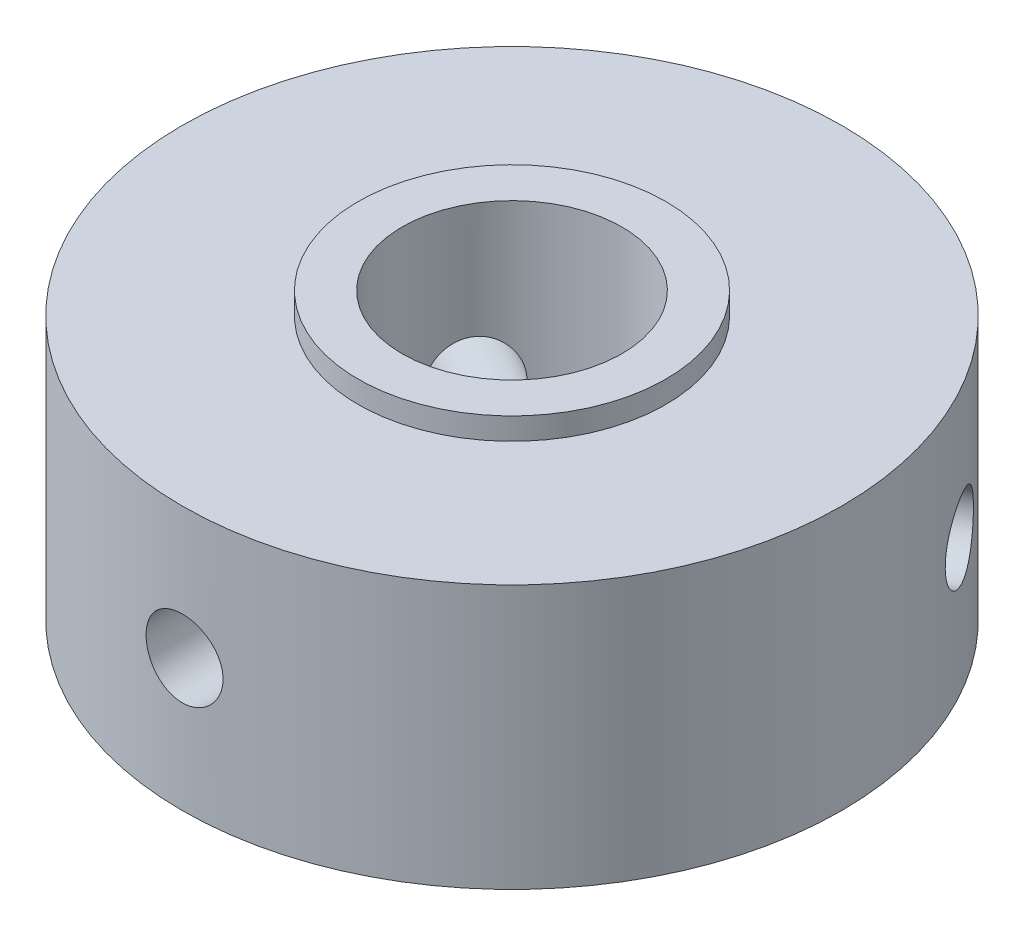
from build123d import *

# Parameters (mm, degrees)
SKETCH1_R               = 15
BOSS_EXTRUDE1_DEPTH     = 12
SKETCH13_R              = 7
BOSS_EXTRUDE3_DEPTH     = 13
CUT_EXTRUDE2_DEPTH      = 25.372115214
CUT_EXTRUDE2_DEPTH_BACK = 25.372115214
SKETCH2_R               = 5
CIRPATTERN1_COUNT       = 3


with BuildPart() as part:
    # Sketch1 → Boss-Extrude1 (new body)
    with BuildSketch(Plane(origin=(0, 0, 0), x_dir=(1, 0, 0), z_dir=(0, 1, 0))):
        with Locations(Location((0, 0, 0), (0, 0, 270))):
            Circle(SKETCH1_R)
    extrude(amount=BOSS_EXTRUDE1_DEPTH)

    # Sketch13 → Boss-Extrude3 (add)
    with BuildSketch(Plane(origin=(0, 0, 0), x_dir=(1, 0, 0), z_dir=(0, 1, 0))):
        with Locations(Location((0, 0, 0), (0, 0, 90))):
            Circle(SKETCH13_R)
    extrude(amount=BOSS_EXTRUDE3_DEPTH)

    # Sketch2 → Cut-Extrude2 (cut, two sides: drawn at the far end of the back side and taken through both)
    with BuildSketch(Plane(origin=(0, 12, 0), x_dir=(1, 0, 0), z_dir=(0, 1, 0)).offset(-CUT_EXTRUDE2_DEPTH_BACK)):
        with Locations(Location((0, 0, 0), (0, 0, 270))):
            Circle(SKETCH2_R)
    extrude(amount=CUT_EXTRUDE2_DEPTH + CUT_EXTRUDE2_DEPTH_BACK, mode=Mode.SUBTRACT)

    # Sketch16 → Ø4.0mm Dowel Hole1 (revolve, cut)
    with BuildSketch(Plane(origin=(0, 6, 15), x_dir=(0, -1, 0), z_dir=(1, 0, 0))):
        Polygon((0, 0), (0, 16.050506083), (1.75, 14.999), (1.75, 0), align=None)
    f_4_0mm_dowel_hole1 = revolve(axis=Axis((0, 6, 21.35), (0, 0, -1)), mode=Mode.SUBTRACT)

    # CirPattern1: Ø4.0mm Dowel Hole1 ×3 about axis
    cirpattern1_axis = Axis((0, 0, 0), (0, 1, 0))
    for i in range(1, CIRPATTERN1_COUNT):
        add(f_4_0mm_dowel_hole1.rotate(cirpattern1_axis, i * 360 / CIRPATTERN1_COUNT), mode=Mode.SUBTRACT)


solid = part.part
